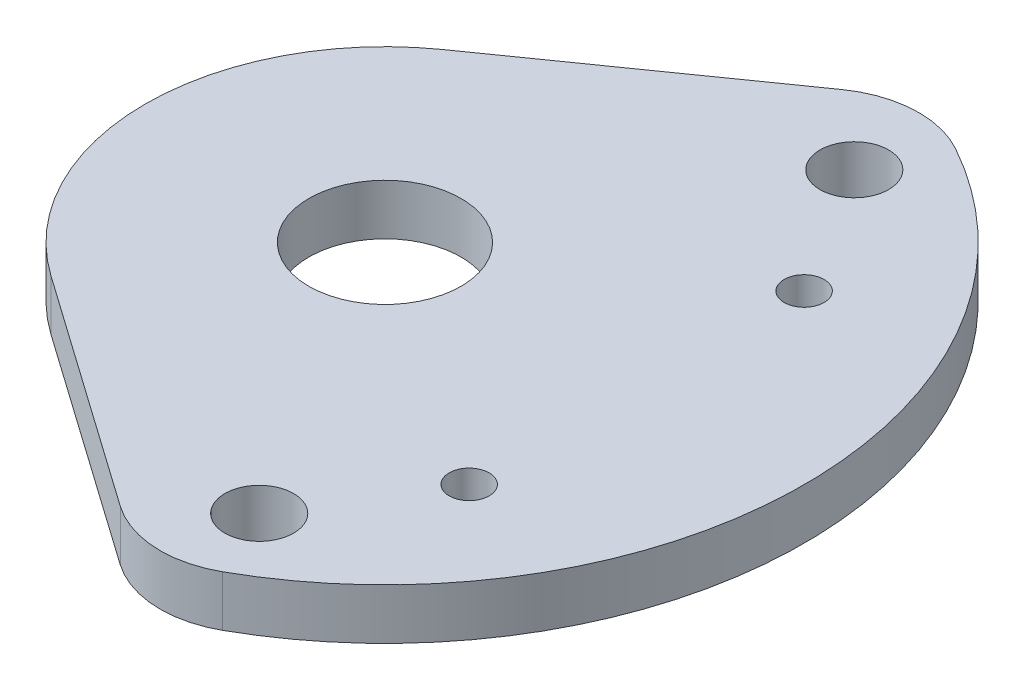
from build123d import *

# Parameters (mm, degrees)
SKETCH1_R                 = 4.7625
BOSS_EXTRUDE1_DEPTH       = 1.5875
M4_CLEARANCE_HOLE1_D      = 4.3
M3X0_5_TAPPED_HOLE1_D     = 2.5
M3X0_5_TAPPED_HOLE1_DEPTH = 3.175
FILLET1_R                 = 6.35


with BuildPart() as part:
    # Sketch1 → Boss-Extrude1 (new, symmetric)
    with BuildSketch(Plane(origin=(0, 0, 0), x_dir=(1, 0, 0), z_dir=(0, 1, 0))):
        with BuildLine():
            Line((-8.635805476, -12.264699906), (8.978028762, -24.666931296))
            ThreePointArc((8.978028762, -24.666931296), (26.25, 0), (8.978028762, 24.666931296))
            Line((8.978028762, 24.666931296), (-8.635805476, 12.264699906))
            ThreePointArc((-8.635805476, 12.264699906), (-15, 0), (-8.635805476, -12.264699906))
        make_face()
        with Locations(Location((0, 0, 0), (0, 0, 270))):
            Circle(SKETCH1_R, mode=Mode.SUBTRACT)
    extrude(amount=BOSS_EXTRUDE1_DEPTH, both=True)

    # M4 Clearance Hole1 (through all)
    with Locations(Plane(origin=(0, 1.5875, 0), x_dir=(1, 0, 0), z_dir=(0, 1, 0))):
        with Locations((10.75, -18.619546181), (10.75, 18.619546181)):
            Hole(M4_CLEARANCE_HOLE1_D / 2)

    # M3x0.5 Tapped Hole1
    with Locations(Plane(origin=(0, 1.5875, 0), x_dir=(1, 0, 0), z_dir=(0, 1, 0))):
        with Locations((0, 0), (15.75, -10.48), (15.75, 10.48)):
            Hole(M3X0_5_TAPPED_HOLE1_D / 2, depth=M3X0_5_TAPPED_HOLE1_DEPTH)

    # Fillet1
    fillet1_edges = [part.edges().sort_by_distance(p)[0] for p in [
        (8.978028762, 0, -24.666931296),
        (8.978028762, 0, 24.666931296),
    ]]
    fillet(fillet1_edges, radius=FILLET1_R)


solid = part.part
